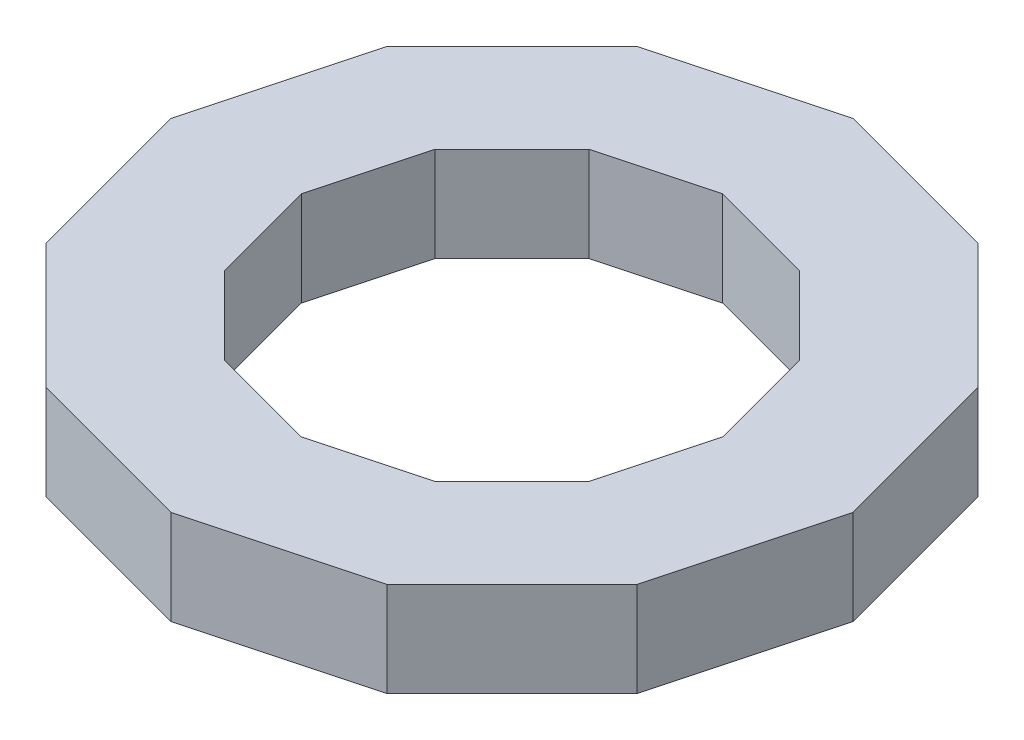
from build123d import *

# Parameters (mm, degrees)
BOSS_EXTRUDE1_DEPTH = 19.05


with BuildPart() as part:
    # Sketch1 → Boss-Extrude1 (new body)
    with BuildSketch(Plane(origin=(0, 0, 0), x_dir=(1, 0, 0), z_dir=(0, 1, 0))):
        Polygon((68.696644766, 0), (59.493039522, 34.348322383), (34.348322383, 59.493039522), (0, 68.696644766), (-34.348322383, 59.493039522), (-59.493039522, 34.348322383), (-68.696644766, 0), (-59.493039522, -34.348322383), (-34.348322383, -59.493039522), (0, -68.696644766), (34.348322383, -59.493039522), (59.493039522, -34.348322383), align=None)
        Polygon((42.400629783, 0), (36.720022529, 21.200314892), (21.200314892, 36.720022529), (0, 42.400629783), (-21.200314892, 36.720022529), (-36.720022529, 21.200314892), (-42.400629783, 0), (-36.720022529, -21.200314892), (-21.200314892, -36.720022529), (0, -42.400629783), (21.200314892, -36.720022529), (36.720022529, -21.200314892), align=None, mode=Mode.SUBTRACT)
    extrude(amount=BOSS_EXTRUDE1_DEPTH)


solid = part.part
